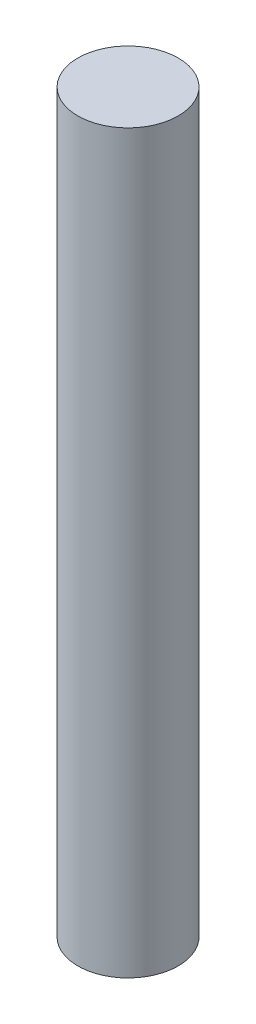
from build123d import *

# Parameters (mm, degrees)
CROQUIS_PERFIL_W           = 15
CROQUIS_PERFIL_H           = 220
CROQUIS_AGUJEROS_MONTAJE_R = 4
AGUJERO_INSERTO_M6_DEPTH   = 14


with BuildPart() as part:
    # Croquis_perfil → Poste_D30x220 (revolve)
    with BuildSketch(Plane.XY, mode=Mode.PRIVATE) as poste_d30x220_sk:
        with Locations((7.5, 110)):
            Rectangle(CROQUIS_PERFIL_W, CROQUIS_PERFIL_H)
    revolve(poste_d30x220_sk.sketch.rotate(Axis((0, 0, 0), (0, 1, 0)), 90), axis=Axis((0, 0, 0), (0, 1, 0)))

    # Croquis_agujeros_montaje → Agujero_inserto_M6 (cut)
    with BuildSketch(Plane(origin=(0, 0, 0), x_dir=(1, 0, 0), z_dir=(0, 1, 0))):
        with Locations(Location((0, 0, 0), (0, 0, 270))):
            Circle(CROQUIS_AGUJEROS_MONTAJE_R)
    extrude(amount=AGUJERO_INSERTO_M6_DEPTH, mode=Mode.SUBTRACT)


solid = part.part
